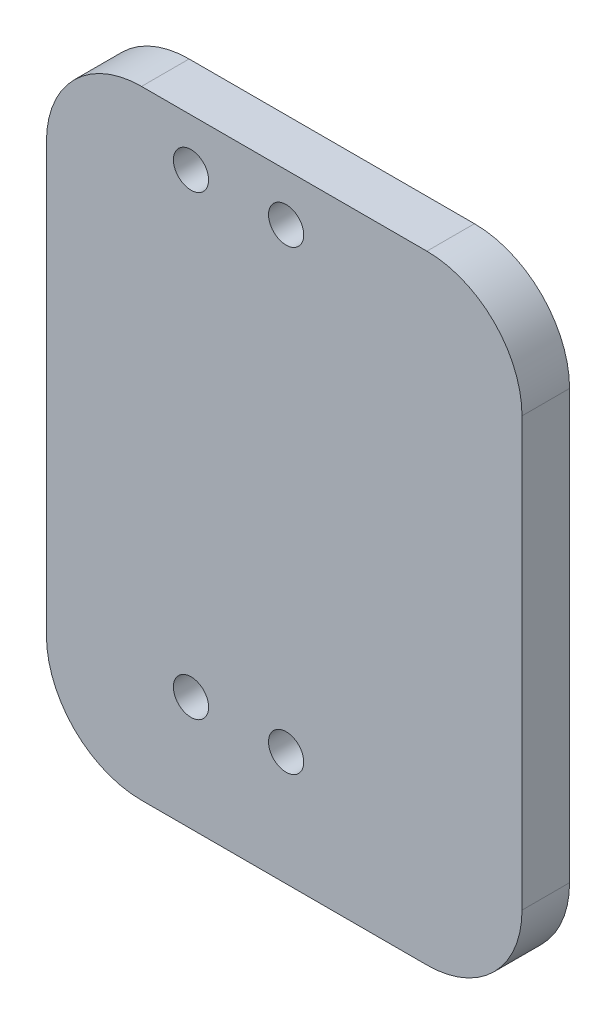
from build123d import *

# Parameters (mm, degrees)
ESQUISSE1_W             = 50
ESQUISSE1_H             = 65
BOSS_EXTRU_1_DEPTH      = 5
ESQUISSE2_R             = 1.85
ENL_V_MAT_EXTRU_1_DEPTH = 42.306779105
CONG_1_R                = 10


with BuildPart() as part:
    # Esquisse1 → Boss.-Extru.1 (new body)
    with BuildSketch(Plane.XY):
        Rectangle(ESQUISSE1_W, ESQUISSE1_H)
    extrude(amount=BOSS_EXTRU_1_DEPTH)

    # Esquisse2 → Enlèv. mat.-Extru.1 (cut, through all)
    with BuildSketch(Plane.XY.offset(5)):
        with Locations((-9.8, -20.5)):
            Circle(ESQUISSE2_R)
        with Locations((0.2, -20.5)):
            Circle(ESQUISSE2_R)
        with Locations((-9.8, 27.5)):
            Circle(ESQUISSE2_R)
        with Locations((0.2, 27.5)):
            Circle(ESQUISSE2_R)
    extrude(amount=-ENL_V_MAT_EXTRU_1_DEPTH, mode=Mode.SUBTRACT)

    # Congé1
    cong_1_edges = [part.edges().sort_by_distance(p)[0] for p in [
        (25, -32.5, 2.5),
        (-25, -32.5, 2.5),
        (-25, 32.5, 2.5),
        (25, 32.5, 2.5),
    ]]
    fillet(cong_1_edges, radius=CONG_1_R)


solid = part.part
